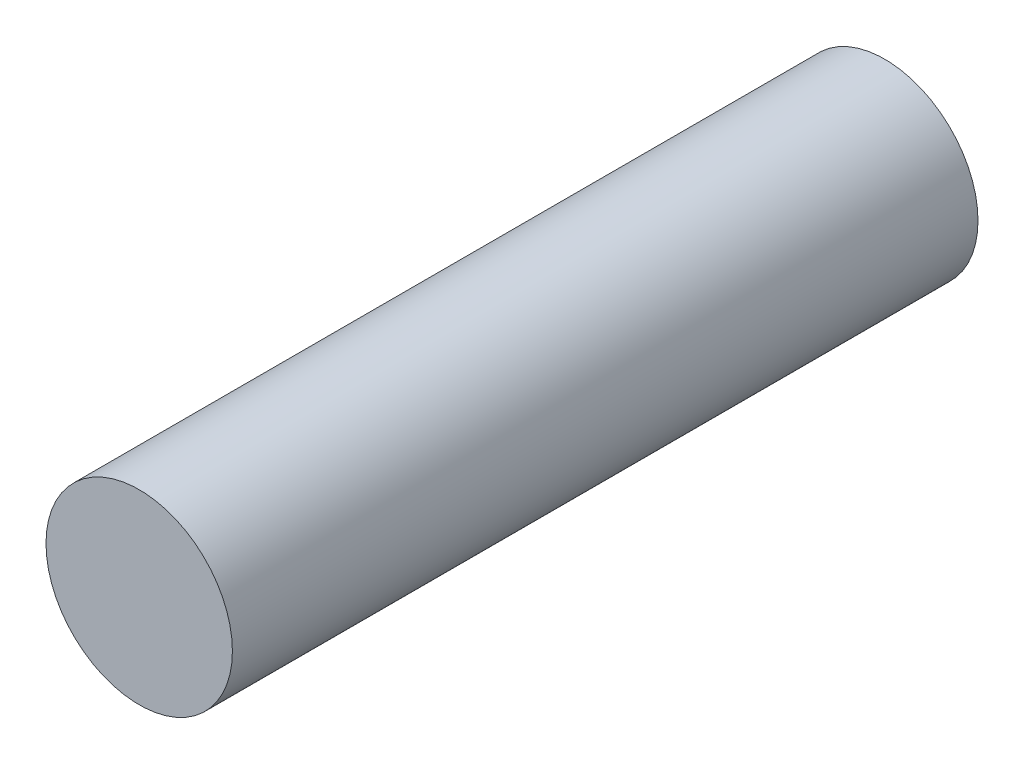
from build123d import *

# Parameters (mm, degrees)
SKETCH1_R           = 17.5
BOSS_EXTRUDE1_DEPTH = 70


with BuildPart() as part:
    # Sketch1 → Boss-Extrude1 (new, symmetric)
    with BuildSketch(Plane.XY):
        Circle(SKETCH1_R)
    extrude(amount=BOSS_EXTRUDE1_DEPTH, both=True)


solid = part.part
